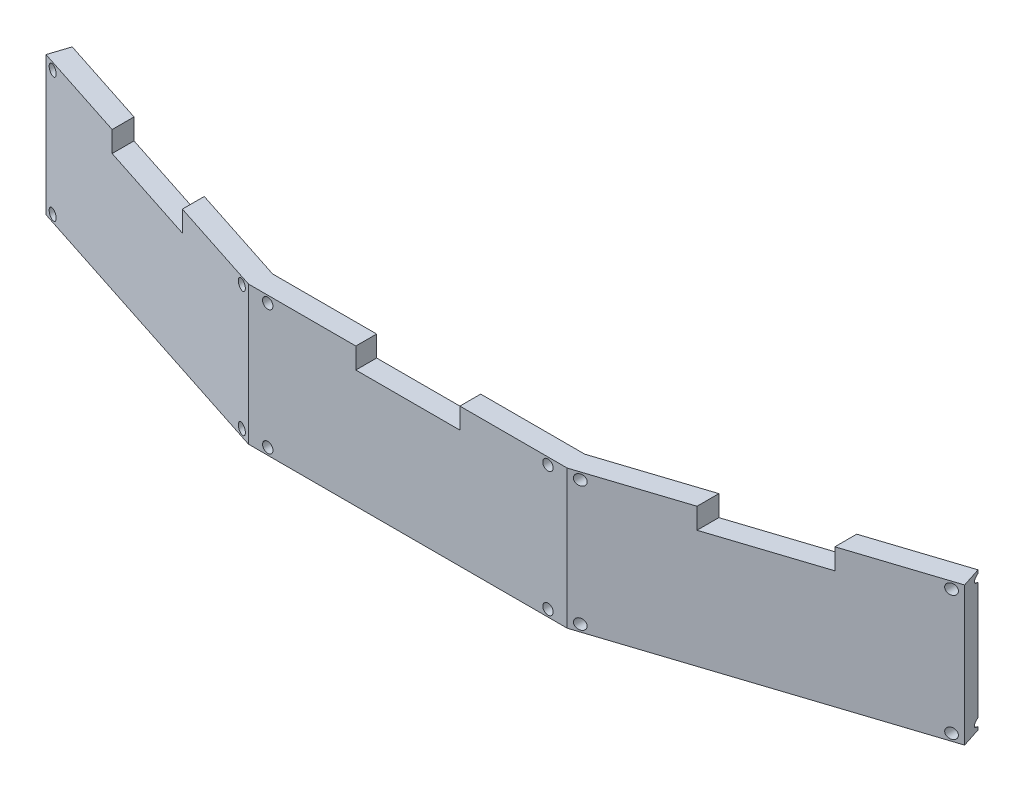
from build123d import *

# Parameters (mm, degrees)
EXTRUDE_THIN1_DEPTH = 20
SKETCH3_R           = 0.75
SKETCH3_W           = 15
SKETCH3_H           = 3
CUT_EXTRUDE1_DEPTH  = 72.214477186


with BuildPart() as part:
    # Sketch2 → Extrude-Thin1 (new body)
    with BuildSketch(Plane(origin=(0, 0, 0), x_dir=(1, 0, 0), z_dir=(0, 1, 0))):
        Polygon((-65.297543233, 13.905764747), (-22.5, 0), (22.5, 0), (65.297543233, 13.905764747), (66.224594216, 11.052595198), (22.975153321, -3), (-22.975153321, -3), (-66.224594216, 11.052595198), align=None)
    extrude(amount=-EXTRUDE_THIN1_DEPTH)

    # Sketch3 → Cut-Extrude1 (cut, through all)
    with BuildSketch(Plane.XY.offset(3)):
        with Locations((-64.799873769, -1)):
            Circle(SKETCH3_R)
        with Locations((-24.399873769, -1)):
            Circle(SKETCH3_R)
        with Locations((-24.399873769, -19)):
            Circle(SKETCH3_R)
        with Locations((-64.799873769, -19)):
            Circle(SKETCH3_R)
        with Locations(Location((64.799873769, -1, 0), (0, 0, 311.57189246))):
            Circle(SKETCH3_R)
        with Locations(Location((24.399873769, -1, 0), (0, 0, 180))):
            Circle(SKETCH3_R)
        with Locations(Location((24.399873769, -19, 0), (0, 0, 180))):
            Circle(SKETCH3_R)
        with Locations(Location((64.799873769, -19, 0), (0, 0, 48.42810754))):
            Circle(SKETCH3_R)
        with Locations((-20.2, -1)):
            Circle(SKETCH3_R)
        with Locations((-20.2, -19)):
            Circle(SKETCH3_R)
        with Locations((20.2, -19)):
            Circle(SKETCH3_R)
        with Locations((20.2, -1)):
            Circle(SKETCH3_R)
        with Locations((0, -1.5)):
            Rectangle(SKETCH3_W, SKETCH3_H)
        with Locations((44.599873769, -1.5)):
            Rectangle(SKETCH3_W, SKETCH3_H)
        with Locations((-44.599873769, -1.5)):
            Rectangle(SKETCH3_W, SKETCH3_H)
    extrude(amount=-CUT_EXTRUDE1_DEPTH, mode=Mode.SUBTRACT)


solid = part.part
